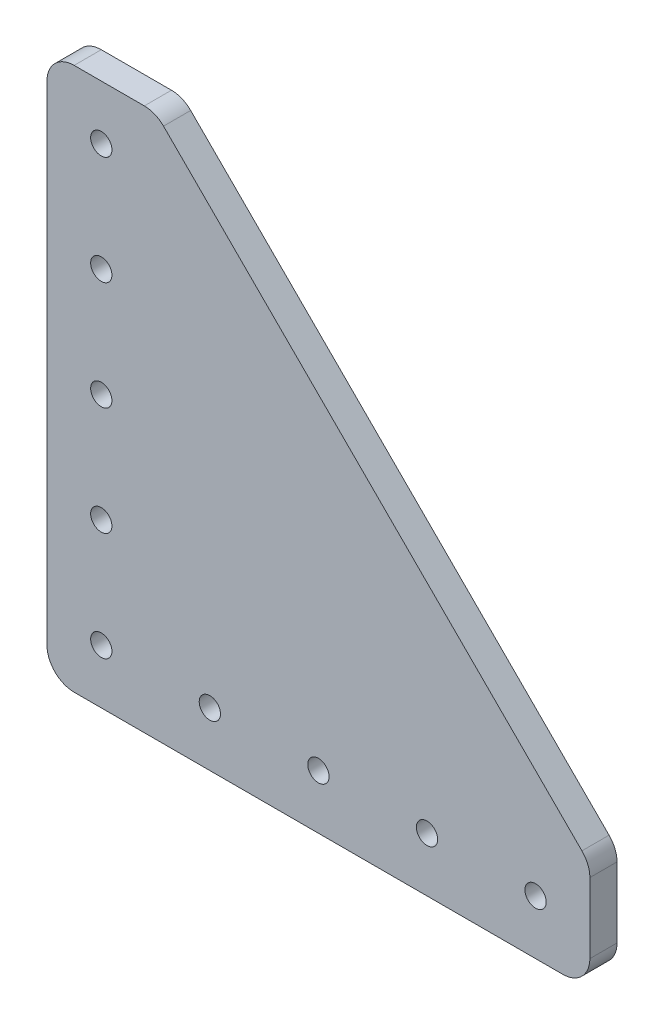
from build123d import *

# Parameters (mm, degrees)
SKETCH1_R           = 2.4892
BOSS_EXTRUDE1_DEPTH = 6.35
FILLET1_R           = 6.35


with BuildPart() as part:
    # Sketch1 → Boss-Extrude1 (new body)
    with BuildSketch(Plane.XY):
        Polygon((0, 0), (0, 127), (25.4, 127), (127, 25.4), (127, 0), align=None)
        with Locations((12.7, 12.7)):
            Circle(SKETCH1_R, mode=Mode.SUBTRACT)
        with Locations((38.1, 12.7)):
            Circle(SKETCH1_R, mode=Mode.SUBTRACT)
        with Locations((63.5, 12.7)):
            Circle(SKETCH1_R, mode=Mode.SUBTRACT)
        with Locations((12.7, 38.1)):
            Circle(SKETCH1_R, mode=Mode.SUBTRACT)
        with Locations((12.7, 63.5)):
            Circle(SKETCH1_R, mode=Mode.SUBTRACT)
        with Locations((12.7, 88.9)):
            Circle(SKETCH1_R, mode=Mode.SUBTRACT)
        with Locations((12.7, 114.3)):
            Circle(SKETCH1_R, mode=Mode.SUBTRACT)
        with Locations((88.9, 12.7)):
            Circle(SKETCH1_R, mode=Mode.SUBTRACT)
        with Locations((114.3, 12.7)):
            Circle(SKETCH1_R, mode=Mode.SUBTRACT)
    extrude(amount=BOSS_EXTRUDE1_DEPTH)

    # Fillet1
    fillet1_edges = [part.edges().sort_by_distance(p)[0] for p in [
        (127, 0, 3.175),
        (0, 0, 3.175),
        (0, 127, 3.175),
        (25.4, 127, 3.175),
        (127, 25.4, 3.175),
    ]]
    fillet(fillet1_edges, radius=FILLET1_R)


solid = part.part
